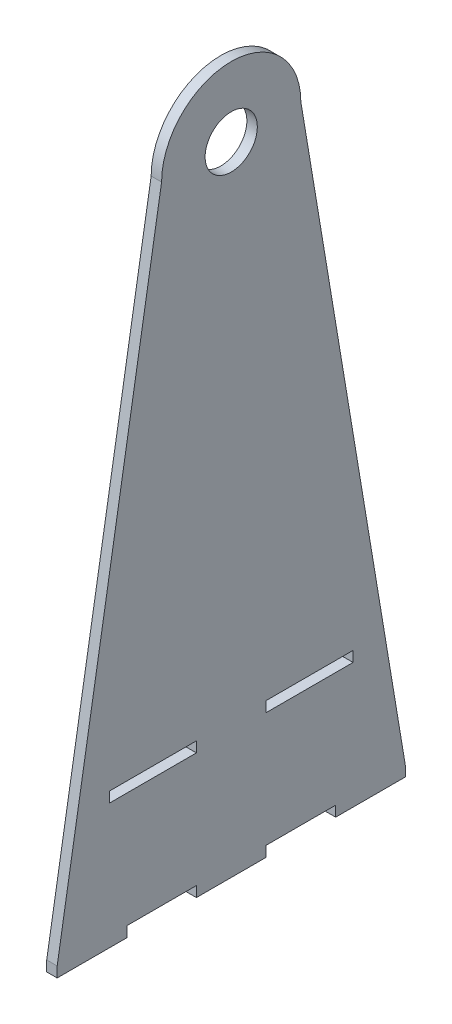
from build123d import *

# Parameters (mm, degrees)
SKETCH2_R           = 7.5
BOSS_EXTRUDE1_DEPTH = 1.5
SKETCH3_W           = 25
SKETCH3_H           = 3
CUT_EXTRUDE1_DEPTH  = 4
SKETCH4_W           = 3
SKETCH4_H           = 20
BOSS_EXTRUDE2_DEPTH = 3


with BuildPart() as part:
    # Sketch2 → Boss-Extrude1 (new, symmetric)
    with BuildSketch(Plane(origin=(0, 0, 0), x_dir=(0, 0, -1), z_dir=(1, 0, 0))):
        with BuildLine():
            Line((50, 0), (-50, 0))
            Line((-50, 0), (-20, 180))
            ThreePointArc((-20, 180), (0, 200), (20, 180))
            Line((20, 180), (50, 0))
        make_face()
        with Locations((0, 180)):
            Circle(SKETCH2_R, mode=Mode.SUBTRACT)
    extrude(amount=BOSS_EXTRUDE1_DEPTH, both=True)

    # Sketch3 → Cut-Extrude1 (cut)
    with BuildSketch(Plane.ZY.offset(1.5)):
        with Locations((22.5, 34.5)):
            Rectangle(SKETCH3_W, SKETCH3_H)
        with Locations((-22.5, 34.5)):
            Rectangle(SKETCH3_W, SKETCH3_H)
    extrude(amount=-CUT_EXTRUDE1_DEPTH, mode=Mode.SUBTRACT)

    # Sketch4 → Boss-Extrude2 (add)
    with BuildSketch(Plane.XZ):
        Rectangle(SKETCH4_W, SKETCH4_H)
        with Locations((0, -40)):
            Rectangle(SKETCH4_W, SKETCH4_H)
        with Locations((0, 40)):
            Rectangle(SKETCH4_W, SKETCH4_H)
    extrude(amount=BOSS_EXTRUDE2_DEPTH)


solid = part.part
